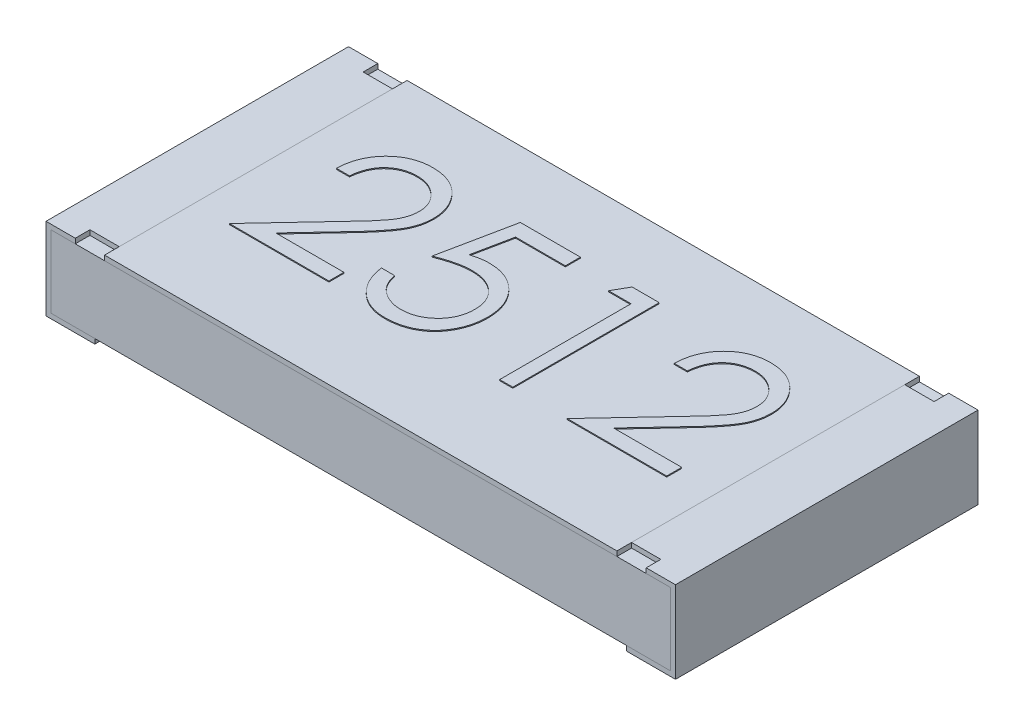
from build123d import *

# Parameters (mm, degrees)
CROQUIS1_W          = 6.35
CROQUIS1_H          = 3.1
EXTRUIR1_DEPTH      = 0.79
CROQUIS2_W          = 6.35
CROQUIS2_H          = 0.05
EXTRUIR2_DEPTH      = 5.507185929
CROQUIS4_W          = 3.1
CROQUIS4_H          = 0.05
EXTRUIR3_DEPTH      = 5.25
CROQUIS5_W          = 0.3
CROQUIS5_H          = 0.15
EXTRUIR4_DEPTH      = 0.05
BOSS_EXTRUDE1_DEPTH = 0.01


with BuildPart() as part:
    # Croquis1 → Extruir1 (new body)
    with BuildSketch(Plane(origin=(0, 0, 0), x_dir=(1, 0, 0), z_dir=(0, 1, 0))):
        Rectangle(CROQUIS1_W, CROQUIS1_H)
    extrude(amount=EXTRUIR1_DEPTH)

    # Croquis2 → Extruir2 (cut, through all)
    with BuildSketch(Plane.XY.offset(1.55)):
        with Locations((0, 0.025)):
            Rectangle(CROQUIS2_W, CROQUIS2_H)
    extrude(amount=-EXTRUIR2_DEPTH, mode=Mode.SUBTRACT)


with BuildPart() as body_2:
    # Barrer1: sweep along a path in Croquis3
    with BuildLine(Plane.XY.offset(1.55)) as barrer1_path:
        Line((-2.625, 0.84), (-3.225, 0.84))
        Line((-3.225, 0.84), (-3.225, 0))
        Line((-3.225, 0), (-2.725, 0))
    # Croquis3D1 → Barrer1 (sweep)
    with BuildSketch(Plane(origin=(-2.625, 0.84, 1.55), x_dir=(0, -0.016126934718260048, -0.9998699525321246), z_dir=(-1, 0, 0))):
        Polygon((0, 0), (3.099596853, -0.049993498), (3.1004032, 0), (0.000806347, 0.049993498), align=None)
    sweep(path=barrer1_path.line, transition=Transition.RIGHT)


with BuildPart() as body_3:
    # Simetría1: mirrored copy
    add(body_2.part.mirror(Plane(origin=(0, 0.79, 1.55), x_dir=(0, 0, 1), z_dir=(1, 0, 0))))


with BuildPart() as body_4:
    # Croquis4 → Extruir3 (new body)
    with BuildSketch(Plane(origin=(-2.625, 0, 0), x_dir=(0, 0, -1), z_dir=(1, 0, 0))):
        with Locations((0, 0.815)):
            Rectangle(CROQUIS4_W, CROQUIS4_H)
    extrude(amount=EXTRUIR3_DEPTH)

    # Sketch1 → Boss-Extrude1 (add)
    with BuildSketch(Plane(origin=(0, 0.84, 0), x_dir=(1, 0, 0), z_dir=(0, 1, 0))):
        with BuildLine():
            Line((-2.063073546, 0.398366008), (-2.19768893, 0.398366008))
            add(Edge.make_bspline(
                [(-2.19768893, 0.398366008), (-2.196811579, 0.41622496), (-2.195088484, 0.451299466), (-2.187019218, 0.502438283), (-2.175473127, 0.551318911), (-2.159148219, 0.597548874), (-2.138874099, 0.641536935), (-2.114561231, 0.68310837), (-2.085763866, 0.722104594), (-2.053103837, 0.758164098), (-2.017631563, 0.791244485), (-1.979357589, 0.819811018), (-1.939138292, 0.843947163), (-1.897095692, 0.864124838), (-1.852755451, 0.879270486), (-1.80651994, 0.890508332), (-1.758186025, 0.897269623), (-1.725254587, 0.897996388), (-1.708506238, 0.898366008)],
                knots=[0, 0, 0, 0, 1.10065271, 2.161652631, 3.183658789, 4.190468796, 5.17591951, 6.163126047, 7.15150782, 8.156236427, 9.156009102, 10.134482811, 11.092018607, 12.041330605, 13.001268258, 13.972401359, 14.968799086, 16, 16, 16, 16], degree=3))
            add(Edge.make_bspline(
                [(-1.708506238, 0.898366008), (-1.692058492, 0.897980955), (-1.659739259, 0.89722434), (-1.612569824, 0.890726756), (-1.567665269, 0.880550074), (-1.525113369, 0.866272039), (-1.485253627, 0.847078713), (-1.447786608, 0.824022625), (-1.412266261, 0.797356983), (-1.380291925, 0.765962491), (-1.350931319, 0.732447184), (-1.325601781, 0.696666654), (-1.303910426, 0.659711245), (-1.285829991, 0.621299159), (-1.272520218, 0.581068718), (-1.262415271, 0.539605631), (-1.256703523, 0.496480712), (-1.255826912, 0.467292188), (-1.255381238, 0.452452547)],
                knots=[0, 0, 0, 0, 1.111607364, 2.184268762, 3.212621178, 4.221274766, 5.211760367, 6.196651075, 7.1921475, 8.207485113, 9.220403448, 10.201281604, 11.166441695, 12.114753415, 13.065576456, 14.026450734, 14.996634279, 16, 16, 16, 16], degree=3))
            add(Edge.make_bspline(
                [(-1.255381238, 0.452452547), (-1.256106922, 0.431560617), (-1.257545556, 0.390143383), (-1.269851717, 0.32927987), (-1.28907165, 0.270311262), (-1.312213375, 0.222852419), (-1.335558708, 0.184609493), (-1.356596211, 0.153122905), (-1.381223987, 0.119220561), (-1.409800486, 0.083015988), (-1.441734574, 0.0442256), (-1.477315502, 0.002872831), (-1.516796994, -0.040615071), (-1.54450778, -0.070317471), (-1.558866815, -0.085708511)],
                knots=[0, 0, 0, 0, 1.184426356, 2.348067706, 3.509069118, 4.696110526, 5.333549288, 6.050745305, 6.844228056, 7.710549037, 8.667450064, 9.695053472, 10.805634456, 12, 12, 12, 12], degree=3))
            Line((-1.558866815, -0.085708511), (-1.934167296, -0.486249376))
            Line((-1.934167296, -0.486249376), (-1.236150469, -0.486249376))
            Line((-1.236150469, -0.486249376), (-1.236150469, -0.64009553))
            Line((-1.236150469, -0.64009553), (-2.255381238, -0.64009553))
            Line((-2.255381238, -0.64009553), (-1.673650469, -0.019302261))
            add(Edge.make_bspline(
                [(-1.673650469, -0.019302261), (-1.659487089, -0.004517273), (-1.632282134, 0.023881665), (-1.593803887, 0.065342933), (-1.559244321, 0.103807022), (-1.528379724, 0.139201257), (-1.50187965, 0.172043358), (-1.478362979, 0.201269659), (-1.459520583, 0.228164424), (-1.439071128, 0.259338972), (-1.419265136, 0.297401394), (-1.402245555, 0.343915832), (-1.391867762, 0.391798941), (-1.390622833, 0.424156956), (-1.389996623, 0.440433316)],
                knots=[0, 0, 0, 0, 1.329631726, 2.553950428, 3.673215718, 4.687767853, 5.603093632, 6.413772471, 7.123043292, 7.734684054, 8.834405432, 9.900288307, 10.943827018, 12, 12, 12, 12], degree=3))
            add(Edge.make_bspline(
                [(-1.389996623, 0.440433316), (-1.390269084, 0.450668201), (-1.390806052, 0.470839194), (-1.395545065, 0.500413091), (-1.402706711, 0.528940868), (-1.412968964, 0.556510276), (-1.42651471, 0.582844127), (-1.443003301, 0.607974476), (-1.462027614, 0.632269746), (-1.484035301, 0.655049731), (-1.508211667, 0.675913105), (-1.533752059, 0.694394856), (-1.560773532, 0.709840189), (-1.589162156, 0.722501688), (-1.618838786, 0.732433994), (-1.64986082, 0.739316243), (-1.682142541, 0.743637307), (-1.704185468, 0.744221952), (-1.715417296, 0.744519854)],
                knots=[0, 0, 0, 0, 0.991446411, 1.95395049, 2.89581595, 3.838931463, 4.798493298, 5.75982156, 6.748411868, 7.785213223, 8.824556874, 9.840280684, 10.836137867, 11.835679398, 12.848801643, 13.863922112, 14.911575587, 16, 16, 16, 16], degree=3))
            add(Edge.make_bspline(
                [(-1.715417296, 0.744519854), (-1.727147653, 0.744213412), (-1.750184137, 0.74361161), (-1.784006579, 0.739401896), (-1.816271913, 0.732139393), (-1.8470613, 0.722206533), (-1.876426836, 0.709581441), (-1.904225712, 0.693856407), (-1.930395522, 0.675092053), (-1.954985461, 0.653817529), (-1.977641452, 0.630131414), (-1.997547256, 0.603727144), (-2.014940405, 0.575086823), (-2.03011579, 0.54428773), (-2.042439657, 0.511050396), (-2.051856722, 0.475492808), (-2.059308228, 0.437769359), (-2.061797594, 0.411718608), (-2.063073546, 0.398366008)],
                knots=[0, 0, 0, 0, 1.031018746, 2.02475058, 2.990194455, 3.934040569, 4.864654155, 5.795059489, 6.735614925, 7.690564532, 8.649604399, 9.611025574, 10.590972636, 11.591080095, 12.624614302, 13.701020113, 14.821632451, 16, 16, 16, 16], degree=3))
        make_face()
        with BuildLine():
            Line((-0.159227392, 0.85990447), (-0.159227392, 0.706058316))
            Line((-0.159227392, 0.706058316), (-0.669443738, 0.706058316))
            Line((-0.669443738, 0.706058316), (-0.750273065, 0.311527066))
            add(Edge.make_bspline(
                [(-0.750273065, 0.311527066), (-0.734391976, 0.315911468), (-0.703624878, 0.324405554), (-0.658213509, 0.333836598), (-0.615102564, 0.339521789), (-0.587127406, 0.340298065), (-0.573590373, 0.3406737)],
                knots=[0, 0, 0, 0, 1.100273476, 2.13160584, 3.095893838, 4, 4, 4, 4], degree=3))
            add(Edge.make_bspline(
                [(-0.573590373, 0.3406737), (-0.556840198, 0.340311157), (-0.523905171, 0.339598305), (-0.475717051, 0.332753226), (-0.42971724, 0.321978977), (-0.386001938, 0.306927325), (-0.344490273, 0.287680297), (-0.305564176, 0.263637465), (-0.268639356, 0.235551752), (-0.234378244, 0.203261032), (-0.203296398, 0.167723196), (-0.175968116, 0.12951268), (-0.152755578, 0.089000825), (-0.134086683, 0.045800564), (-0.119179111, 0.000389498), (-0.109256828, -0.04771018), (-0.102649667, -0.098045088), (-0.101911501, -0.132461333), (-0.101535084, -0.150011396)],
                knots=[0, 0, 0, 0, 1.052922333, 2.070308379, 3.05430497, 4.020497103, 4.973039431, 5.925935799, 6.892292201, 7.88610001, 8.88166317, 9.857072816, 10.836096531, 11.812156883, 12.81219415, 13.836441305, 14.89672472, 16, 16, 16, 16], degree=3))
            add(Edge.make_bspline(
                [(-0.101535084, -0.150011396), (-0.101820116, -0.162235204), (-0.102386329, -0.186517628), (-0.105265724, -0.222579428), (-0.110809602, -0.257877785), (-0.118252912, -0.292417382), (-0.127913949, -0.326132827), (-0.139609257, -0.359120624), (-0.153921841, -0.391175456), (-0.169621001, -0.422600625), (-0.187298063, -0.4526857), (-0.206917424, -0.48082098), (-0.227645491, -0.507428529), (-0.249948942, -0.532222986), (-0.274035083, -0.555041422), (-0.299612212, -0.576019257), (-0.326476234, -0.595511256), (-0.355042767, -0.612726197), (-0.384675259, -0.628567463), (-0.415801638, -0.641563265), (-0.447713367, -0.653182063), (-0.480869742, -0.662443289), (-0.515195662, -0.669700098), (-0.550747708, -0.674628927), (-0.587339424, -0.678218829), (-0.612143001, -0.678443553), (-0.624672103, -0.678557069)],
                knots=[0, 0, 0, 0, 1.056347294, 2.098418968, 3.122841568, 4.141288669, 5.149314143, 6.15115421, 7.162517403, 8.180376062, 9.185164535, 10.17417709, 11.141909838, 12.097768115, 13.052685741, 14.0056014, 14.954263652, 15.917497458, 16.885230207, 17.854509472, 18.828990115, 19.81800267, 20.826176721, 21.857883937, 22.917946725, 24, 24, 24, 24], degree=3))
            add(Edge.make_bspline(
                [(-0.624672103, -0.678557069), (-0.639618181, -0.678260995), (-0.669022823, -0.677678506), (-0.712103066, -0.671584869), (-0.753552182, -0.662857477), (-0.793036511, -0.649727647), (-0.83090991, -0.633275949), (-0.866662503, -0.612483304), (-0.901207836, -0.588920831), (-0.933141566, -0.561114965), (-0.9627799, -0.53072253), (-0.989311261, -0.497740684), (-1.012939937, -0.46271378), (-1.033287543, -0.425471714), (-1.050643838, -0.386112344), (-1.064278833, -0.344488201), (-1.075283842, -0.30081677), (-1.079939594, -0.27075098), (-1.082304315, -0.255480146)],
                knots=[0, 0, 0, 0, 1.0467383, 2.05933395, 3.04377827, 4.011590433, 4.970194871, 5.932262533, 6.905835911, 7.896367577, 8.894135286, 9.877477877, 10.858688626, 11.851381753, 12.8477658, 13.868841284, 14.917554742, 16, 16, 16, 16], degree=3))
            Line((-1.082304315, -0.255480146), (-0.94768893, -0.255480146))
            add(Edge.make_bspline(
                [(-0.94768893, -0.255480146), (-0.944376691, -0.26978434), (-0.938010384, -0.297277795), (-0.924036492, -0.335905512), (-0.906951117, -0.370328037), (-0.886634968, -0.401000715), (-0.86239924, -0.427747428), (-0.834743771, -0.451583312), (-0.803737604, -0.473086939), (-0.769283362, -0.491010982), (-0.7329349, -0.506297591), (-0.69489181, -0.516476888), (-0.656189947, -0.523634414), (-0.630013503, -0.524350883), (-0.616859603, -0.524710915)],
                knots=[0, 0, 0, 0, 1.136247022, 2.183929868, 3.172523383, 4.106158343, 5.02341133, 5.958108904, 6.928429099, 7.938127109, 8.96079061, 9.975095812, 10.982467395, 12, 12, 12, 12], degree=3))
            add(Edge.make_bspline(
                [(-0.616859603, -0.524710915), (-0.60402027, -0.524359153), (-0.578739518, -0.523666531), (-0.541534638, -0.518335526), (-0.505614834, -0.510125138), (-0.471334539, -0.497838057), (-0.438093879, -0.482904606), (-0.406733692, -0.463741003), (-0.376346744, -0.441686709), (-0.347877544, -0.416419582), (-0.321803494, -0.388575427), (-0.298765157, -0.358799401), (-0.279575051, -0.327035038), (-0.26340329, -0.293832259), (-0.251123305, -0.258827163), (-0.242362884, -0.222183802), (-0.237218716, -0.183811667), (-0.236511068, -0.157639106), (-0.236150469, -0.144302261)],
                knots=[0, 0, 0, 0, 1.027316725, 2.022795036, 3.002884548, 3.971462791, 4.93288096, 5.914575861, 6.907176829, 7.935150275, 8.956128384, 9.956726525, 10.942570165, 11.921478529, 12.907843606, 13.90538589, 14.932640048, 16, 16, 16, 16], degree=3))
            add(Edge.make_bspline(
                [(-0.236150469, -0.144302261), (-0.236432674, -0.132269796), (-0.236985051, -0.108717958), (-0.241498153, -0.074261155), (-0.249348284, -0.041658423), (-0.260244232, -0.010752323), (-0.274078307, 0.018486296), (-0.29098387, 0.046087607), (-0.311278183, 0.071687821), (-0.334460421, 0.095298916), (-0.359856724, 0.117089576), (-0.387904043, 0.135665614), (-0.41801544, 0.151293007), (-0.449828125, 0.164779292), (-0.484098796, 0.174465326), (-0.520148781, 0.181737276), (-0.55836737, 0.18594386), (-0.584497665, 0.186527527), (-0.597929315, 0.186827547)],
                knots=[0, 0, 0, 0, 1.045622112, 2.046656509, 3.013763289, 3.955457236, 4.890082067, 5.820317437, 6.762574623, 7.722996705, 8.69280354, 9.665887285, 10.63943826, 11.638615906, 12.663482002, 13.728887084, 14.832589034, 16, 16, 16, 16], degree=3))
            add(Edge.make_bspline(
                [(-0.597929315, 0.186827547), (-0.609555999, 0.186578722), (-0.633562151, 0.186064962), (-0.67038622, 0.182282177), (-0.709082672, 0.176179623), (-0.74950317, 0.167785517), (-0.791769102, 0.156800769), (-0.835791274, 0.143637412), (-0.881662246, 0.127899413), (-0.912569842, 0.116014178), (-0.928458161, 0.10990447)],
                knots=[0, 0, 0, 0, 0.817624296, 1.688186739, 2.600797293, 3.572016777, 4.590301741, 5.671205678, 6.80286297, 8, 8, 8, 8], degree=3))
            Line((-0.928458161, 0.10990447), (-0.774612007, 0.85990447))
            Line((-0.774612007, 0.85990447), (-0.159227392, 0.85990447))
        make_face()
        Polygon((0.371121166, 0.85990447), (0.648464916, 0.85990447), (0.648464916, -0.64009553), (0.513849531, -0.64009553), (0.513849531, 0.706058316), (0.2830803, 0.706058316), align=None)
        with BuildLine():
            Line((1.398464916, 0.398366008), (1.263849531, 0.398366008))
            add(Edge.make_bspline(
                [(1.263849531, 0.398366008), (1.264726883, 0.41622496), (1.266449977, 0.451299466), (1.274519244, 0.502438283), (1.286065334, 0.551318911), (1.302390243, 0.597548874), (1.322664362, 0.641536935), (1.346977231, 0.68310837), (1.375774595, 0.722104594), (1.408434624, 0.758164098), (1.443906898, 0.791244485), (1.482180872, 0.819811018), (1.52240017, 0.843947163), (1.564442769, 0.864124838), (1.608783011, 0.879270486), (1.655018521, 0.890508332), (1.703352437, 0.897269623), (1.736283875, 0.897996388), (1.753032224, 0.898366008)],
                knots=[0, 0, 0, 0, 1.10065271, 2.161652631, 3.183658789, 4.190468796, 5.17591951, 6.163126047, 7.15150782, 8.156236427, 9.156009102, 10.134482811, 11.092018607, 12.041330605, 13.001268258, 13.972401359, 14.968799086, 16, 16, 16, 16], degree=3))
            add(Edge.make_bspline(
                [(1.753032224, 0.898366008), (1.76947997, 0.897980955), (1.801799203, 0.89722434), (1.848968638, 0.890726756), (1.893873193, 0.880550074), (1.936425092, 0.866272039), (1.976284834, 0.847078713), (2.013751854, 0.824022625), (2.049272201, 0.797356983), (2.081246537, 0.765962491), (2.110607142, 0.732447184), (2.13593668, 0.696666654), (2.157628036, 0.659711245), (2.17570847, 0.621299159), (2.189018244, 0.581068718), (2.19912319, 0.539605631), (2.204834939, 0.496480712), (2.205711549, 0.467292188), (2.206157224, 0.452452547)],
                knots=[0, 0, 0, 0, 1.111607364, 2.184268762, 3.212621178, 4.221274766, 5.211760367, 6.196651075, 7.1921475, 8.207485113, 9.220403448, 10.201281604, 11.166441695, 12.114753415, 13.065576456, 14.026450734, 14.996634279, 16, 16, 16, 16], degree=3))
            add(Edge.make_bspline(
                [(2.206157224, 0.452452547), (2.205431539, 0.431560617), (2.203992906, 0.390143383), (2.191686745, 0.32927987), (2.172466811, 0.270311262), (2.149325087, 0.222852419), (2.125979754, 0.184609493), (2.104942251, 0.153122905), (2.080314474, 0.119220561), (2.051737975, 0.083015988), (2.019803887, 0.0442256), (1.98422296, 0.002872831), (1.944741468, -0.040615071), (1.917030682, -0.070317471), (1.902671647, -0.085708511)],
                knots=[0, 0, 0, 0, 1.184426356, 2.348067706, 3.509069118, 4.696110526, 5.333549288, 6.050745305, 6.844228056, 7.710549037, 8.667450064, 9.695053472, 10.805634456, 12, 12, 12, 12], degree=3))
            Line((1.902671647, -0.085708511), (1.527371166, -0.486249376))
            Line((1.527371166, -0.486249376), (2.225387993, -0.486249376))
            Line((2.225387993, -0.486249376), (2.225387993, -0.64009553))
            Line((2.225387993, -0.64009553), (1.206157224, -0.64009553))
            Line((1.206157224, -0.64009553), (1.787887993, -0.019302261))
            add(Edge.make_bspline(
                [(1.787887993, -0.019302261), (1.802051373, -0.004517273), (1.829256327, 0.023881665), (1.867734574, 0.065342933), (1.902294141, 0.103807022), (1.933158738, 0.139201257), (1.959658812, 0.172043358), (1.983175482, 0.201269659), (2.002017879, 0.228164424), (2.022467334, 0.259338972), (2.042273326, 0.297401394), (2.059292907, 0.343915832), (2.069670699, 0.391798941), (2.070915629, 0.424156956), (2.071541839, 0.440433316)],
                knots=[0, 0, 0, 0, 1.329631726, 2.553950428, 3.673215718, 4.687767853, 5.603093632, 6.413772471, 7.123043292, 7.734684054, 8.834405432, 9.900288307, 10.943827018, 12, 12, 12, 12], degree=3))
            add(Edge.make_bspline(
                [(2.071541839, 0.440433316), (2.071269378, 0.450668201), (2.07073241, 0.470839194), (2.065993396, 0.500413091), (2.058831751, 0.528940868), (2.048569498, 0.556510276), (2.035023752, 0.582844127), (2.01853516, 0.607974476), (1.999510847, 0.632269746), (1.977503161, 0.655049731), (1.953326795, 0.675913105), (1.927786402, 0.694394856), (1.900764929, 0.709840189), (1.872376305, 0.722501688), (1.842699676, 0.732433994), (1.811677642, 0.739316243), (1.779395921, 0.743637307), (1.757352994, 0.744221952), (1.746121166, 0.744519854)],
                knots=[0, 0, 0, 0, 0.991446411, 1.95395049, 2.89581595, 3.838931463, 4.798493298, 5.75982156, 6.748411868, 7.785213223, 8.824556874, 9.840280684, 10.836137867, 11.835679398, 12.848801643, 13.863922112, 14.911575587, 16, 16, 16, 16], degree=3))
            add(Edge.make_bspline(
                [(1.746121166, 0.744519854), (1.734390809, 0.744213412), (1.711354325, 0.74361161), (1.677531882, 0.739401896), (1.645266549, 0.732139393), (1.614477162, 0.722206533), (1.585111625, 0.709581441), (1.557312749, 0.693856407), (1.531142939, 0.675092053), (1.506553001, 0.653817529), (1.48389701, 0.630131414), (1.463991206, 0.603727144), (1.446598057, 0.575086823), (1.431422671, 0.54428773), (1.419098804, 0.511050396), (1.40968174, 0.475492808), (1.402230234, 0.437769359), (1.399740868, 0.411718608), (1.398464916, 0.398366008)],
                knots=[0, 0, 0, 0, 1.031018746, 2.02475058, 2.990194455, 3.934040569, 4.864654155, 5.795059489, 6.735614925, 7.690564532, 8.649604399, 9.611025574, 10.590972636, 11.591080095, 12.624614302, 13.701020113, 14.821632451, 16, 16, 16, 16], degree=3))
        make_face()
    extrude(amount=BOSS_EXTRUDE1_DEPTH)


with BuildPart() as extruir4_tool:
    # Croquis5 → Extruir4 (new body)
    with BuildSketch(Plane(origin=(0, 0.84, 0), x_dir=(1, 0, 0), z_dir=(0, 1, 0))):
        with Locations((-2.775, -1.475)):
            Rectangle(CROQUIS5_W, CROQUIS5_H)
        with Locations((-2.775, 1.475)):
            Rectangle(CROQUIS5_W, CROQUIS5_H)
        with Locations((2.775, 1.475)):
            Rectangle(CROQUIS5_W, CROQUIS5_H)
        with Locations((2.775, -1.475)):
            Rectangle(CROQUIS5_W, CROQUIS5_H)
    extrude(amount=-EXTRUIR4_DEPTH)


with BuildPart() as body_2_1:
    add(body_2.part)

    # Extruir4: cut by extruir4_tool
    add(extruir4_tool.part, mode=Mode.SUBTRACT)


with BuildPart() as body_3_1:
    add(body_3.part)

    # Extruir4: cut by extruir4_tool
    add(extruir4_tool.part, mode=Mode.SUBTRACT)


solid = Compound([part.part, body_4.part, body_2_1.part, body_3_1.part])
